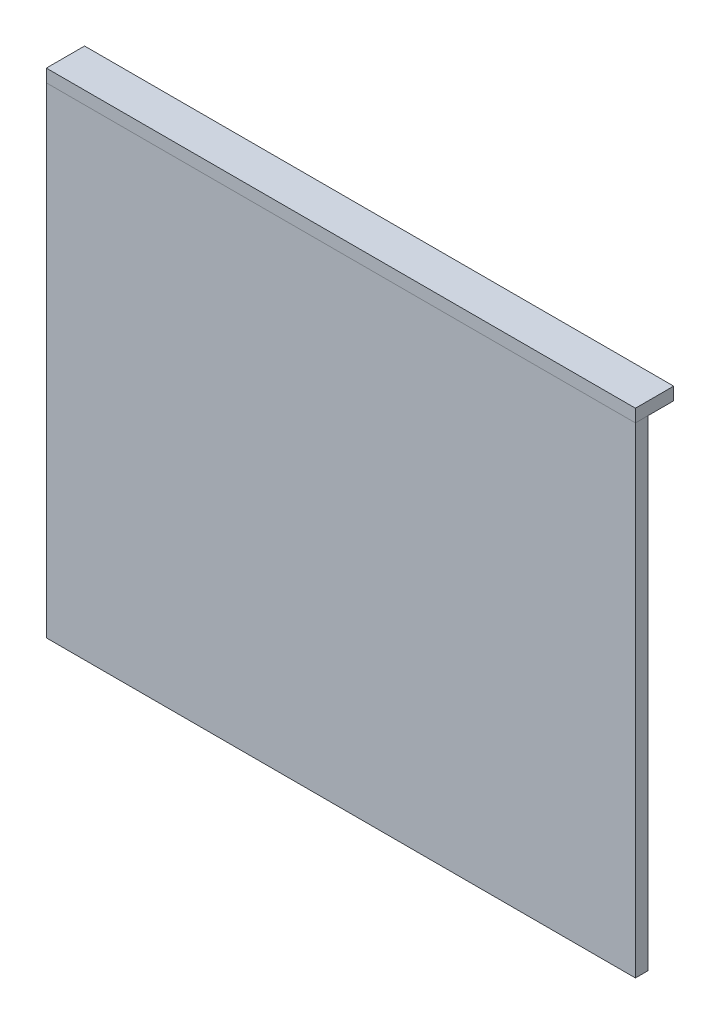
from build123d import *

# Parameters (mm, degrees)
SKETCH1_W           = 586.74
SKETCH1_H           = 478.79
BOSS_EXTRUDE1_DEPTH = 12.7
SKETCH2_W           = 586.74
SKETCH2_H           = 38.1
BOSS_EXTRUDE2_DEPTH = 12.7


with BuildPart() as part:
    # Sketch1 → Boss-Extrude1 (new body)
    with BuildSketch(Plane.XY):
        with Locations((1375.27385267, 401.401856284)):
            Rectangle(SKETCH1_W, SKETCH1_H)
    extrude(amount=-BOSS_EXTRUDE1_DEPTH)


with BuildPart() as body_2:
    # Sketch2 → Boss-Extrude2 (new body)
    with BuildSketch(Plane(origin=(0, 640.796856284, 0), x_dir=(1, 0, 0), z_dir=(0, 1, 0))):
        with Locations((1375.27385267, 19.05)):
            Rectangle(SKETCH2_W, SKETCH2_H)
    extrude(amount=BOSS_EXTRUDE2_DEPTH)


solid = Compound([part.part, body_2.part])
